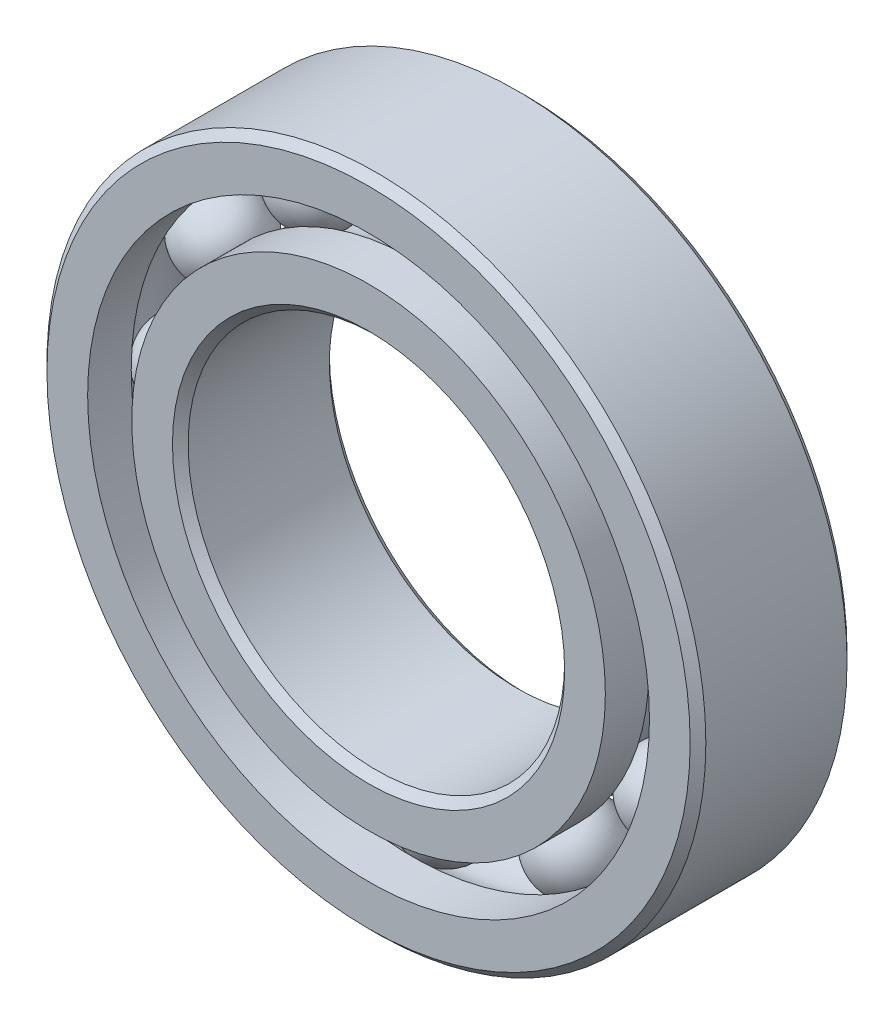
from build123d import *

# Parameters (mm, degrees)
CIRPATTERN1_COUNT = 12


with BuildPart() as part:
    # Sketch1 → Revolve1 (revolve)
    with BuildSketch(Plane(origin=(0, 0, 0), x_dir=(0, 0, -1), z_dir=(1, 0, 0))):
        with BuildLine():
            Line((2.25, 10.5), (-2.25, 10.5))
            Line((-2.25, 10.5), (-2.5, 10.25))
            Line((-2.5, 10.25), (-2.5, 8.953296703))
            Line((-2.5, 8.953296703), (-1.111111111, 8.953296703))
            ThreePointArc((-1.111111111, 8.953296703), (0, 9.564988271), (1.111111111, 8.953296703))
            Line((1.111111111, 8.953296703), (2.5, 8.953296703))
            Line((2.5, 8.953296703), (2.5, 10.25))
            Line((2.5, 10.25), (2.25, 10.5))
        make_face()
    revolve(axis=Axis((0, 0, 2.5), (0, 0, -1)))


with BuildPart() as body_2:
    # Sketch3 → Revolve3 (revolve)
    with BuildSketch(Plane(origin=(0, 0, 0), x_dir=(0, 0, -1), z_dir=(1, 0, 0))):
        with BuildLine():
            Line((-2.5, 7.546703297), (-1.111111111, 7.546703297))
            ThreePointArc((-1.111111111, 7.546703297), (0, 6.935011729), (1.111111111, 7.546703297))
            Line((1.111111111, 7.546703297), (2.5, 7.546703297))
            Line((2.5, 7.546703297), (2.5, 6.25))
            Line((2.5, 6.25), (2.25, 6))
            Line((2.25, 6), (-2.25, 6))
            Line((-2.25, 6), (-2.5, 6.25))
            Line((-2.5, 6.25), (-2.5, 7.546703297))
        make_face()
    revolve(axis=Axis((0, 0, 2.5), (0, 0, -1)))


with BuildPart() as body_3:
    # Sketch4 → Revolve4 (revolve)
    with BuildSketch(Plane(origin=(0, 0, 0), x_dir=(0, 0, -1), z_dir=(1, 0, 0))):
        with BuildLine():
            Line((-1.314988271, 8.25), (1.314988271, 8.25))
            ThreePointArc((1.314988271, 8.25), (0, 9.564988271), (-1.314988271, 8.25))
        make_face()
    revolve(axis=Axis((0, 8.25, 1.314988271), (0, 0, -1)))


with BuildPart() as cirpattern1_1:
    # CirPattern1: pattern copy
    add(body_3.part.rotate(Axis((0, 0, -2.5), (0, 0, 1)), 1 * 360 / CIRPATTERN1_COUNT))


with BuildPart() as cirpattern1_2:
    # CirPattern1: pattern copy
    add(body_3.part.rotate(Axis((0, 0, -2.5), (0, 0, 1)), 2 * 360 / CIRPATTERN1_COUNT))


with BuildPart() as cirpattern1_3:
    # CirPattern1: pattern copy
    add(body_3.part.rotate(Axis((0, 0, -2.5), (0, 0, 1)), 3 * 360 / CIRPATTERN1_COUNT))


with BuildPart() as cirpattern1_4:
    # CirPattern1: pattern copy
    add(body_3.part.rotate(Axis((0, 0, -2.5), (0, 0, 1)), 4 * 360 / CIRPATTERN1_COUNT))


with BuildPart() as cirpattern1_5:
    # CirPattern1: pattern copy
    add(body_3.part.rotate(Axis((0, 0, -2.5), (0, 0, 1)), 5 * 360 / CIRPATTERN1_COUNT))


with BuildPart() as cirpattern1_6:
    # CirPattern1: pattern copy
    add(body_3.part.rotate(Axis((0, 0, -2.5), (0, 0, 1)), 6 * 360 / CIRPATTERN1_COUNT))


with BuildPart() as cirpattern1_7:
    # CirPattern1: pattern copy
    add(body_3.part.rotate(Axis((0, 0, -2.5), (0, 0, 1)), 7 * 360 / CIRPATTERN1_COUNT))


with BuildPart() as cirpattern1_8:
    # CirPattern1: pattern copy
    add(body_3.part.rotate(Axis((0, 0, -2.5), (0, 0, 1)), 8 * 360 / CIRPATTERN1_COUNT))


with BuildPart() as cirpattern1_9:
    # CirPattern1: pattern copy
    add(body_3.part.rotate(Axis((0, 0, -2.5), (0, 0, 1)), 9 * 360 / CIRPATTERN1_COUNT))


with BuildPart() as cirpattern1_10:
    # CirPattern1: pattern copy
    add(body_3.part.rotate(Axis((0, 0, -2.5), (0, 0, 1)), 10 * 360 / CIRPATTERN1_COUNT))


with BuildPart() as cirpattern1_11:
    # CirPattern1: pattern copy
    add(body_3.part.rotate(Axis((0, 0, -2.5), (0, 0, 1)), 11 * 360 / CIRPATTERN1_COUNT))


solid = Compound([part.part, body_2.part, body_3.part, cirpattern1_1.part, cirpattern1_2.part, cirpattern1_3.part, cirpattern1_4.part, cirpattern1_5.part, cirpattern1_6.part, cirpattern1_7.part, cirpattern1_8.part, cirpattern1_9.part, cirpattern1_10.part, cirpattern1_11.part])
